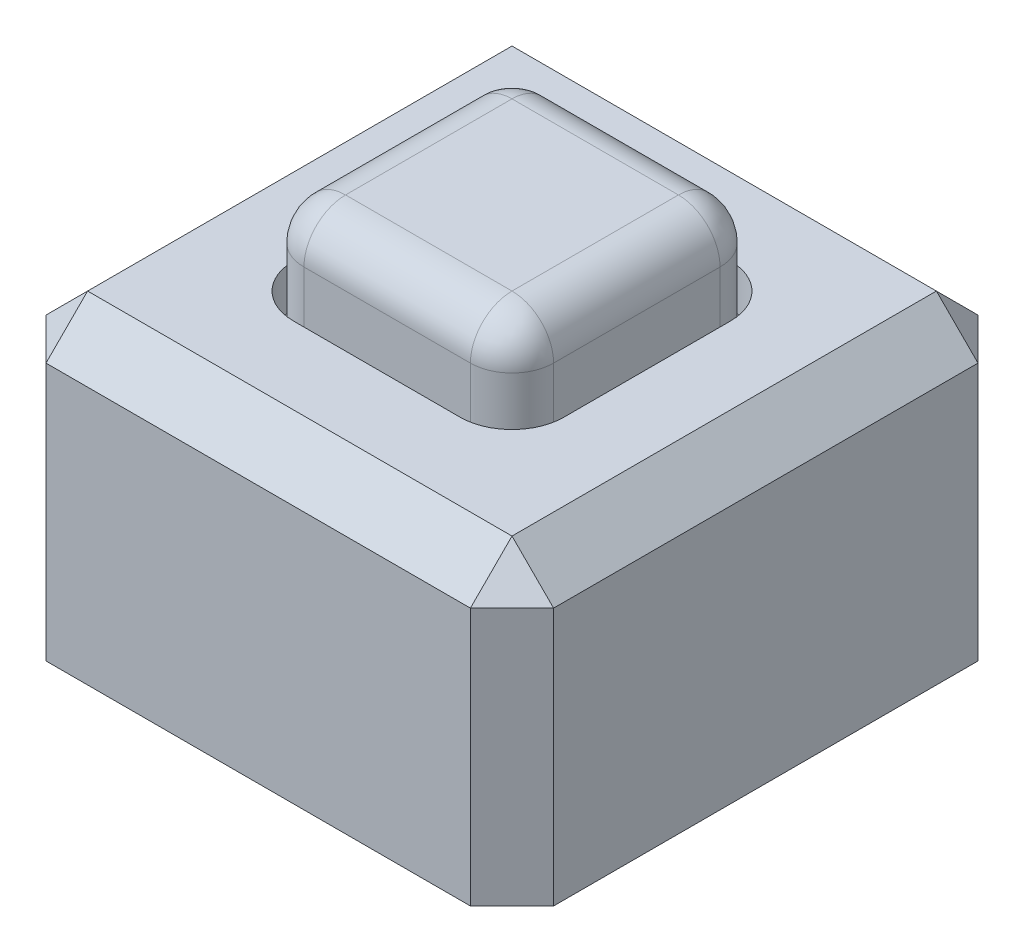
from build123d import *

# Parameters (mm, degrees)
BOSS_EXTRUDE1_DEPTH = 1
BOSS_EXTRUDE2_DEPTH = 4
FILLET1_R           = 1
SKETCH2_W           = 12.2
SKETCH2_H           = 12.2
SKETCH2_R           = 0.2
BOSS_EXTRUDE3_DEPTH = 6.2
SKETCH2_3_W         = 12.2
SKETCH2_3_H         = 12.2
SKETCH2_3_R         = 0.2
BOSS_EXTRUDE4_DEPTH = 1
CHAMFER1_SIZE       = 1


with BuildPart() as part:
    # Sketch1 → Boss-Extrude1 (new body)
    with BuildSketch(Plane(origin=(0, 0, 0), x_dir=(1, 0, 0), z_dir=(0, 1, 0))):
        with BuildLine():
            Line((-4, -2), (-4, 2))
            ThreePointArc((-4, 2), (-3.414213562, 3.414213562), (-2, 4))
            Line((-2, 4), (2, 4))
            ThreePointArc((2, 4), (3.414213562, 3.414213562), (4, 2))
            Line((4, 2), (4, -2))
            ThreePointArc((4, -2), (3.414213562, -3.414213562), (2, -4))
            Line((2, -4), (-2, -4))
            ThreePointArc((-2, -4), (-3.414213562, -3.414213562), (-4, -2))
        make_face()
        with BuildLine():
            Line((-2, -3), (2, -3))
            ThreePointArc((2, -3), (2.707106781, -2.707106781), (3, -2))
            Line((3, -2), (3, 2))
            ThreePointArc((3, 2), (2.707106781, 2.707106781), (2, 3))
            Line((2, 3), (-2, 3))
            ThreePointArc((-2, 3), (-2.707106781, 2.707106781), (-3, 2))
            Line((-3, 2), (-3, -2))
            ThreePointArc((-3, -2), (-2.707106781, -2.707106781), (-2, -3))
        make_face(mode=Mode.SUBTRACT)
    extrude(amount=BOSS_EXTRUDE1_DEPTH)

    # Sketch1<2> → Boss-Extrude2 (add)
    with BuildSketch(Plane(origin=(0, 0, 0), x_dir=(1, 0, 0), z_dir=(0, 1, 0))):
        with BuildLine():
            ThreePointArc((-3, 2), (-2.707106781, 2.707106781), (-2, 3))
            Line((-2, 3), (2, 3))
            ThreePointArc((2, 3), (2.707106781, 2.707106781), (3, 2))
            Line((3, 2), (3, -2))
            ThreePointArc((3, -2), (2.707106781, -2.707106781), (2, -3))
            Line((2, -3), (-2, -3))
            ThreePointArc((-2, -3), (-2.707106781, -2.707106781), (-3, -2))
            Line((-3, -2), (-3, 2))
        make_face()
    extrude(amount=BOSS_EXTRUDE2_DEPTH)

    # Fillet1
    fillet1_edges = [part.edges().sort_by_distance(p)[0] for p in [
        (0, 4, 3),
        (2.707106781, 4, 2.707106781),
        (3, 4, 0),
        (-2.707106781, 4, -2.707106781),
        (-3, 4, 0),
        (-2.707106781, 4, 2.707106781),
        (2.707106781, 4, -2.707106781),
        (0, 4, -3),
    ]]
    fillet(fillet1_edges, radius=FILLET1_R)


with BuildPart() as body_2:
    # Sketch2 → Boss-Extrude3 (new body)
    with BuildSketch(Plane(origin=(0, 1, 0), x_dir=(1, 0, 0), z_dir=(0, 1, 0))):
        Rectangle(SKETCH2_W, SKETCH2_H)
        with Locations(Location((4.38, -4.38, 0), (0, 0, 270))):
            Circle(SKETCH2_R, mode=Mode.SUBTRACT)
        with Locations(Location((4.38, 4.38, 0), (0, 0, 270))):
            Circle(SKETCH2_R, mode=Mode.SUBTRACT)
        with Locations(Location((-4.38, 4.38, 0), (0, 0, 270))):
            Circle(SKETCH2_R, mode=Mode.SUBTRACT)
        with Locations(Location((-4.38, -4.38, 0), (0, 0, 270))):
            Circle(SKETCH2_R, mode=Mode.SUBTRACT)
        with BuildLine():
            ThreePointArc((-4.1, -3.1), (-3.807106781, -3.807106781), (-3.1, -4.1))
            Line((-3.1, -4.1), (3.1, -4.1))
            ThreePointArc((3.1, -4.1), (3.807106781, -3.807106781), (4.1, -3.1))
            Line((4.1, -3.1), (4.1, 3.1))
            ThreePointArc((4.1, 3.1), (3.807106781, 3.807106781), (3.1, 4.1))
            Line((3.1, 4.1), (-3.1, 4.1))
            ThreePointArc((-3.1, 4.1), (-3.807106781, 3.807106781), (-4.1, 3.1))
            Line((-4.1, 3.1), (-4.1, -3.1))
        make_face(mode=Mode.SUBTRACT)
    extrude(amount=-BOSS_EXTRUDE3_DEPTH)

    # Sketch2<3> → Boss-Extrude4 (add)
    # profile 1 of 7: a face of its own
    with BuildSketch(Plane(origin=(0, 1, 0), x_dir=(1, 0, 0), z_dir=(0, 1, 0))):
        Rectangle(SKETCH2_3_W, SKETCH2_3_H)
        with Locations(Location((4.38, -4.38, 0), (0, 0, 270))):
            Circle(SKETCH2_3_R, mode=Mode.SUBTRACT)
        with Locations(Location((4.38, 4.38, 0), (0, 0, 270))):
            Circle(SKETCH2_3_R, mode=Mode.SUBTRACT)
        with Locations(Location((-4.38, 4.38, 0), (0, 0, 270))):
            Circle(SKETCH2_3_R, mode=Mode.SUBTRACT)
        with Locations(Location((-4.38, -4.38, 0), (0, 0, 270))):
            Circle(SKETCH2_3_R, mode=Mode.SUBTRACT)
        with BuildLine():
            ThreePointArc((-4.1, -3.1), (-3.807106781, -3.807106781), (-3.1, -4.1))
            Line((-3.1, -4.1), (3.1, -4.1))
            ThreePointArc((3.1, -4.1), (3.807106781, -3.807106781), (4.1, -3.1))
            Line((4.1, -3.1), (4.1, 3.1))
            ThreePointArc((4.1, 3.1), (3.807106781, 3.807106781), (3.1, 4.1))
            Line((3.1, 4.1), (-3.1, 4.1))
            ThreePointArc((-3.1, 4.1), (-3.807106781, 3.807106781), (-4.1, 3.1))
            Line((-4.1, 3.1), (-4.1, -3.1))
        make_face(mode=Mode.SUBTRACT)
    # profile 2 of 7: a face of its own
    with BuildSketch(Plane(origin=(0, 1, 0), x_dir=(1, 0, 0), z_dir=(0, 1, 0))):
        with BuildLine():
            Line((-4.1, 3.1), (-4.1, -3.1))
            ThreePointArc((-4.1, -3.1), (-3.807106781, -3.807106781), (-3.1, -4.1))
            Line((-3.1, -4.1), (3.1, -4.1))
            ThreePointArc((3.1, -4.1), (3.807106781, -3.807106781), (4.1, -3.1))
            Line((4.1, -3.1), (4.1, 3.1))
            ThreePointArc((4.1, 3.1), (3.807106781, 3.807106781), (3.1, 4.1))
            Line((3.1, 4.1), (-3.1, 4.1))
            ThreePointArc((-3.1, 4.1), (-3.807106781, 3.807106781), (-4.1, 3.1))
        make_face()
        with BuildLine():
            ThreePointArc((-4, -2), (-3.414213562, -3.414213562), (-2, -4))
            Line((-2, -4), (2, -4))
            ThreePointArc((2, -4), (3.414213562, -3.414213562), (4, -2))
            Line((4, -2), (4, 2))
            ThreePointArc((4, 2), (3.414213562, 3.414213562), (2, 4))
            Line((2, 4), (-2, 4))
            ThreePointArc((-2, 4), (-3.414213562, 3.414213562), (-4, 2))
            Line((-4, 2), (-4, -2))
        make_face(mode=Mode.SUBTRACT)
    # profile 3 of 7: a face of its own
    with BuildSketch(Plane(origin=(0, 1, 0), x_dir=(1, 0, 0), z_dir=(0, 1, 0))):
        with BuildLine():
            Line((-4, 2), (-4, -2))
            ThreePointArc((-4, -2), (-3.414213562, -3.414213562), (-2, -4))
            Line((-2, -4), (2, -4))
            ThreePointArc((2, -4), (3.414213562, -3.414213562), (4, -2))
            Line((4, -2), (4, 2))
            ThreePointArc((4, 2), (3.414213562, 3.414213562), (2, 4))
            Line((2, 4), (-2, 4))
            ThreePointArc((-2, 4), (-3.414213562, 3.414213562), (-4, 2))
        make_face()
        with BuildLine():
            ThreePointArc((-3.25, -2), (-2.883883476, -2.883883476), (-2, -3.25))
            Line((-2, -3.25), (2, -3.25))
            ThreePointArc((2, -3.25), (2.883883476, -2.883883476), (3.25, -2))
            Line((3.25, -2), (3.25, 2))
            ThreePointArc((3.25, 2), (2.883883476, 2.883883476), (2, 3.25))
            Line((2, 3.25), (-2, 3.25))
            ThreePointArc((-2, 3.25), (-2.883883476, 2.883883476), (-3.25, 2))
            Line((-3.25, 2), (-3.25, -2))
        make_face(mode=Mode.SUBTRACT)
    # profile 4 of 7: a face of its own
    with BuildSketch(Plane(origin=(0, 1, 0), x_dir=(1, 0, 0), z_dir=(0, 1, 0))):
        with Locations(Location((4.38, -4.38, 0), (0, 0, 270))):
            Circle(SKETCH2_3_R)
    # profile 5 of 7: a face of its own
    with BuildSketch(Plane(origin=(0, 1, 0), x_dir=(1, 0, 0), z_dir=(0, 1, 0))):
        with Locations(Location((-4.38, -4.38, 0), (0, 0, 270))):
            Circle(SKETCH2_3_R)
    # profile 6 of 7: a face of its own
    with BuildSketch(Plane(origin=(0, 1, 0), x_dir=(1, 0, 0), z_dir=(0, 1, 0))):
        with Locations(Location((-4.38, 4.38, 0), (0, 0, 270))):
            Circle(SKETCH2_3_R)
    # profile 7 of 7: a face of its own
    with BuildSketch(Plane(origin=(0, 1, 0), x_dir=(1, 0, 0), z_dir=(0, 1, 0))):
        with Locations(Location((4.38, 4.38, 0), (0, 0, 270))):
            Circle(SKETCH2_3_R)
    extrude(amount=BOSS_EXTRUDE4_DEPTH)

    # Chamfer1
    chamfer1_edges = [body_2.edges().sort_by_distance(p)[0] for p in [
        (6.1, -1.6, -6.1),
        (6.1, -1.6, 6.1),
        (-6.1, -1.6, 6.1),
        (-6.1, -1.6, -6.1),
        (0, 2, -6.1),
        (6.1, 2, 0),
        (-6.1, 2, 0),
        (0, 2, 6.1),
    ]]
    chamfer(chamfer1_edges, length=CHAMFER1_SIZE)


solid = Compound([part.part, body_2.part])
